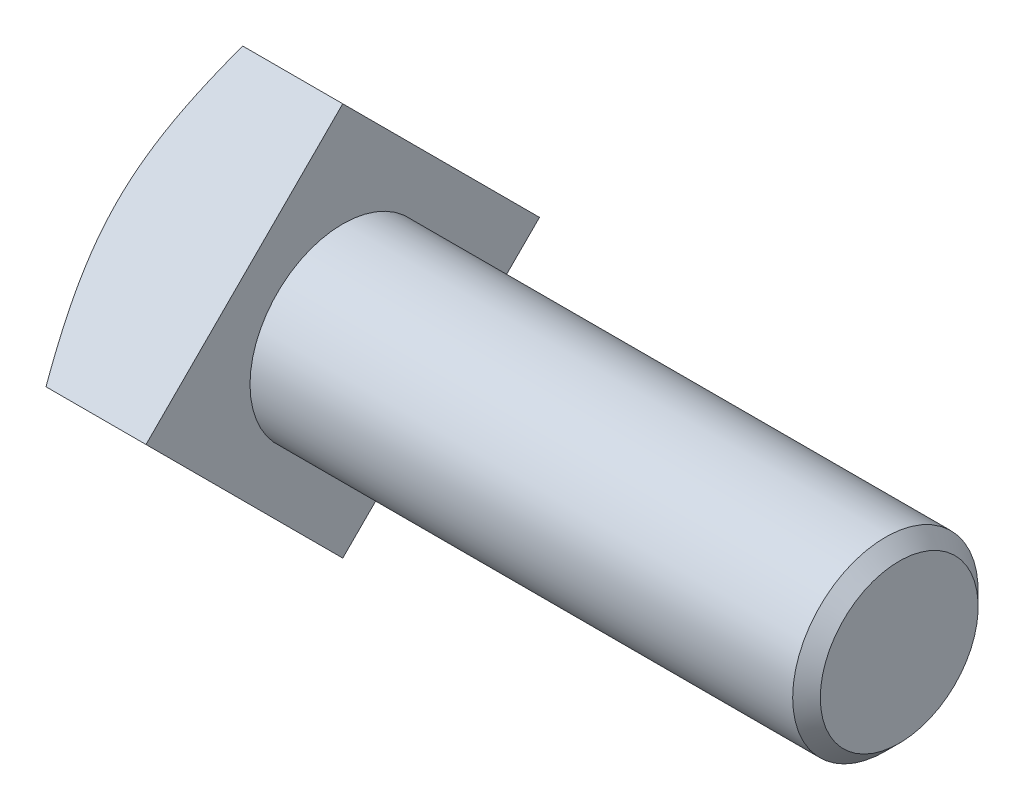
from build123d import *

# Parameters (mm, degrees)
SKETCH1_W      = 38.1
SKETCH1_H      = 38.1
BASEHEAD_DEPTH = 17.3736


with BuildPart() as part:
    # Sketch1 → BaseHead (new body)
    with BuildSketch(Plane(origin=(0, 0, 0), x_dir=(0, 0.7071067811865488, -0.7071067811865462), z_dir=(1, 0, 0))):
        Rectangle(SKETCH1_W, SKETCH1_H)
    extrude(amount=BASEHEAD_DEPTH)

    # BodySke → Body (revolve)
    with BuildSketch(Plane.XY):
        Polygon((17.3736, 0), (17.3736, 12.7), (91.6813, 12.7), (93.5736, 10.8077), (93.5736, 0), align=None)
    revolve(axis=Axis((0, 0, 0), (1, 0, 0)))

    # Sketch3 → HeadChamfer (revolve, cut)
    with BuildSketch(Plane.XY):
        Polygon((0, 19.05), (-12.7, 19.05), (-12.7, 52.340768363), (15.523740234, 52.340768363), align=None)
    revolve(axis=Axis((0, 0, 0), (1, 0, 0)), mode=Mode.SUBTRACT)


solid = part.part
